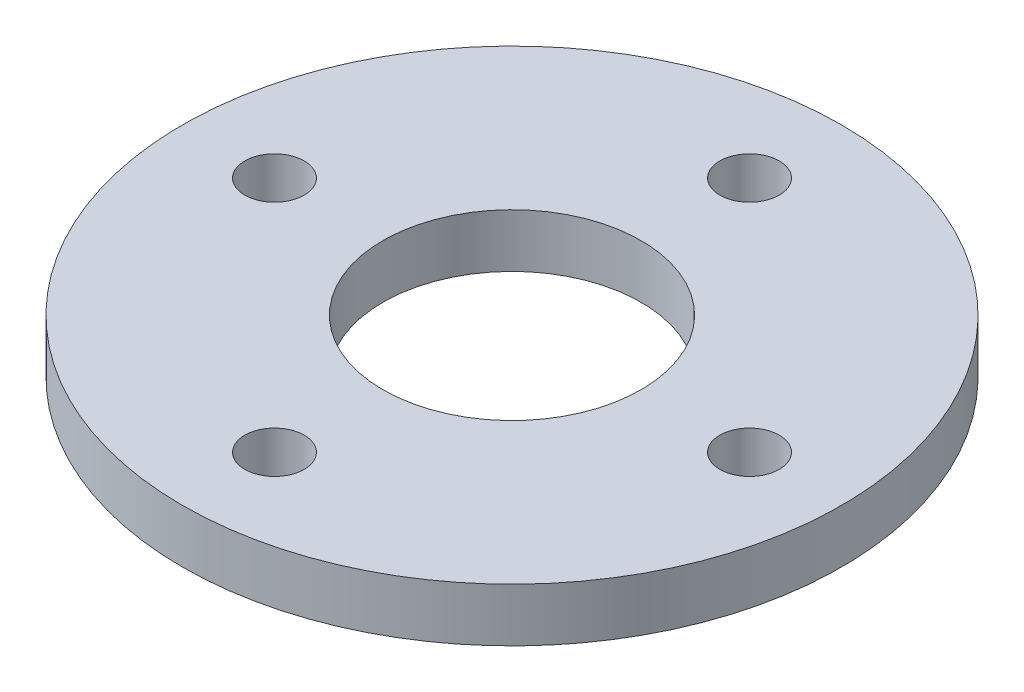
from build123d import *

# Parameters (mm, degrees)
CROQUIS1_R              = 11.1
CROQUIS1_R_2            = 1
CROQUIS1_R_3            = 4.35
SALIENTE_EXTRUIR1_DEPTH = 1.8


with BuildPart() as part:
    # Croquis1 → Saliente-Extruir1 (new body)
    with BuildSketch(Plane(origin=(0, -55.841040513, 0), x_dir=(1, 0, 0), z_dir=(0, 1, 0))):
        with Locations(Location((-3.729637197, 32.694922326, 0), (0, 0, 270))):
            Circle(CROQUIS1_R)
        with Locations(Location((-11.729637197, 32.694922326, 0), (0, 0, 270))):
            Circle(CROQUIS1_R_2, mode=Mode.SUBTRACT)
        with Locations(Location((-3.729637197, 40.694922326, 0), (0, 0, 270))):
            Circle(CROQUIS1_R_2, mode=Mode.SUBTRACT)
        with Locations(Location((4.270362803, 32.694922326, 0), (0, 0, 270))):
            Circle(CROQUIS1_R_2, mode=Mode.SUBTRACT)
        with Locations(Location((-3.729637197, 24.694922326, 0), (0, 0, 270))):
            Circle(CROQUIS1_R_2, mode=Mode.SUBTRACT)
        with Locations(Location((-3.729637197, 32.694922326, 0), (0, 0, 270))):
            Circle(CROQUIS1_R_3, mode=Mode.SUBTRACT)
    extrude(amount=SALIENTE_EXTRUIR1_DEPTH)


solid = part.part
